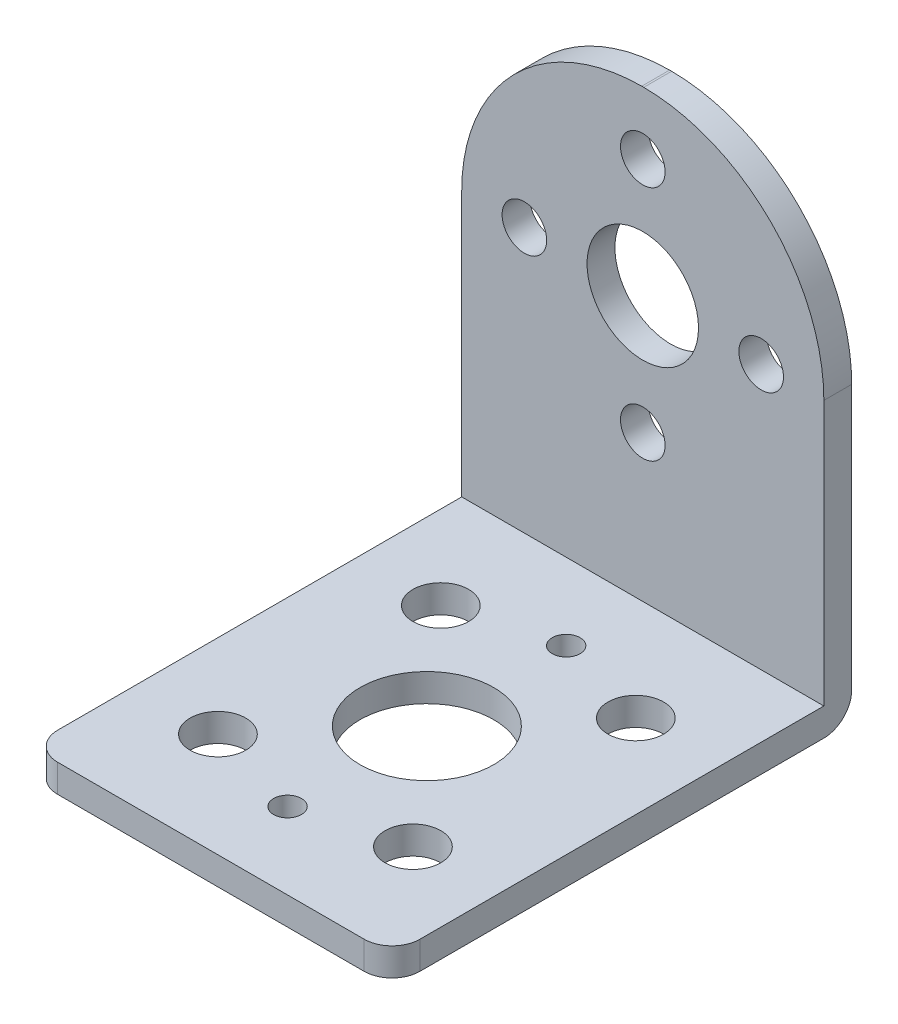
from build123d import *

# Parameters (mm, degrees)
SKETCH1_W        = 26
SKETCH1_H        = 31
SKETCH1_R        = 4.8
SKETCH1_R_2      = 2
SKETCH1_R_3      = 1
EXTRUSION1_DEPTH = 2
SKETCH2_W        = 26
SKETCH2_H        = 2
EXTRUSION2_DEPTH = 34
SKETCH3_R        = 1.6
SKETCH3_R_2      = 4
SKETCH3_R_3      = 0.0001
EXTRUSION3_DEPTH = 34
FILLET1_R        = 2
FILLET2_R        = 2


with BuildPart() as part:
    # Sketch1 → Extrusion1 (new body)
    with BuildSketch(Plane(origin=(0, 0, 0), x_dir=(-1, 0, 0), z_dir=(0, 1, 0))):
        Rectangle(SKETCH1_W, SKETCH1_H)
        with Locations(Location((0, 0, 0), (0, 0, 90))):
            Circle(SKETCH1_R, mode=Mode.SUBTRACT)
        with Locations(Location((7, 8, 0), (0, 0, 90))):
            Circle(SKETCH1_R_2, mode=Mode.SUBTRACT)
        with Locations(Location((7, -8, 0), (0, 0, 90))):
            Circle(SKETCH1_R_2, mode=Mode.SUBTRACT)
        with Locations(Location((-7, -8, 0), (0, 0, 90))):
            Circle(SKETCH1_R_2, mode=Mode.SUBTRACT)
        with Locations(Location((-7, 8, 0), (0, 0, 90))):
            Circle(SKETCH1_R_2, mode=Mode.SUBTRACT)
        with Locations(Location((0, 10, 0), (0, 0, 90))):
            Circle(SKETCH1_R_3, mode=Mode.SUBTRACT)
        with Locations(Location((0, -10, 0), (0, 0, 90))):
            Circle(SKETCH1_R_3, mode=Mode.SUBTRACT)
    extrude(amount=EXTRUSION1_DEPTH)

    # Sketch2 → Extrusion2 (add)
    with BuildSketch(Plane(origin=(0, 0, 0), x_dir=(-1, 0, 0), z_dir=(0, 1, 0))):
        with Locations((0, -16.5)):
            Rectangle(SKETCH2_W, SKETCH2_H)
    extrude(amount=EXTRUSION2_DEPTH)

    # Sketch3 → Extrusion3 (cut)
    with BuildSketch(Plane.XY.offset(-15.5)):
        with Locations((0, 29.5)):
            Circle(SKETCH3_R)
        with Locations((8.5, 21)):
            Circle(SKETCH3_R)
        with Locations((0, 12.5)):
            Circle(SKETCH3_R)
        with Locations((-8.5, 21)):
            Circle(SKETCH3_R)
        with Locations((0, 21)):
            Circle(SKETCH3_R_2)
        with Locations((-0.072111026, 33.9999)):
            Circle(SKETCH3_R_3)
        with Locations((0.072111026, 33.9999)):
            Circle(SKETCH3_R_3)
        with BuildLine():
            Line((-0.072111026, 34), (-13, 34))
            Line((-13, 34), (-13, 21))
            ThreePointArc((-13, 21), (-9.2178478, 30.166857801), (-0.072111026, 34))
        make_face()
        with BuildLine():
            Line((13, 21), (13, 34))
            Line((13, 34), (0.072111026, 34))
            ThreePointArc((0.072111026, 34), (9.2178478, 30.166857801), (13, 21))
        make_face()
    extrude(amount=-EXTRUSION3_DEPTH, mode=Mode.SUBTRACT)

    # Fillet1
    fillet1_edges = [part.edges().sort_by_distance(p)[0] for p in [
        (0, 0, -17.5),
    ]]
    fillet(fillet1_edges, radius=FILLET1_R)

    # Fillet2
    fillet2_edges = [part.edges().sort_by_distance(p)[0] for p in [
        (-13, 1, 15.5),
        (13, 1, 15.5),
    ]]
    fillet(fillet2_edges, radius=FILLET2_R)


solid = part.part
